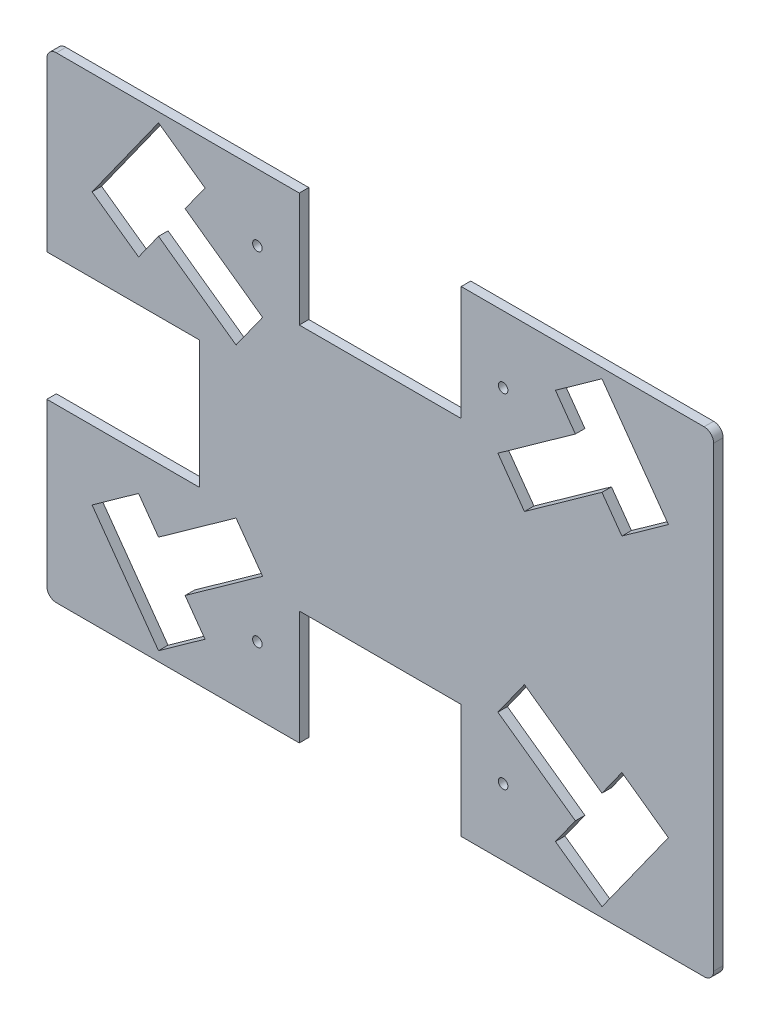
from build123d import *

# Parameters (mm, degrees)
ESQUISSE1_W              = 350
ESQUISSE1_H              = 250
BOSS_EXTRU_1_DEPTH       = 5
ENL_V_MAT_EXTRU_1_DEPTH  = 5
CONG_1_R                 = 5
ESQUISSE8_W              = 85
ESQUISSE8_H              = 60
ENL_V_MAT_EXTRU_12_DEPTH = 5
ESQUISSE9_R              = 2.5
ENL_V_MAT_EXTRU_14_DEPTH = 5
ESQUISSE10_W             = 80
ESQUISSE10_H             = 67
ENL_V_MAT_EXTRU_15_DEPTH = 10


with BuildPart() as part:
    # Esquisse1 → Boss.-Extru.1 (new body)
    with BuildSketch(Plane.XY):
        with Locations((0, 125)):
            Rectangle(ESQUISSE1_W, ESQUISSE1_H)
    extrude(amount=BOSS_EXTRU_1_DEPTH)

    # Esquisse2 → Enlèv. mat.-Extru.1 (cut)
    with BuildSketch(Plane.XY):
        Polygon((-61.749658188, 183.853742021), (-75.699374837, 164.324138712), (-116.386048398, 193.386048398), (-126.848335885, 178.738845916), (-151.260340021, 196.175991728), (-116.386048398, 245), (-91.974044262, 227.562854188), (-102.436331748, 212.915651707), align=None)
        Polygon((61.749658188, 183.853742021), (75.699374837, 164.324138712), (116.386048398, 193.386048398), (126.848335885, 178.738845916), (151.260340021, 196.175991728), (116.386048398, 245), (91.974044262, 227.562854188), (102.436331748, 212.915651707), align=None)
        Polygon((61.749658188, 66.146257979), (75.699374837, 85.675861288), (116.386048398, 56.613951602), (126.848335885, 71.261154084), (151.260340021, 53.824008272), (116.386048398, 5), (91.974044262, 22.437145812), (102.436331748, 37.084348293), align=None)
        Polygon((-61.749658188, 66.146257979), (-75.699374837, 85.675861288), (-116.386048398, 56.613951602), (-126.848335885, 71.261154084), (-151.260340021, 53.824008272), (-116.386048398, 5), (-91.974044262, 22.437145812), (-102.436331748, 37.084348293), align=None)
    extrude(amount=ENL_V_MAT_EXTRU_1_DEPTH, mode=Mode.SUBTRACT)

    # Congé1
    cong_1_edges = [part.edges().sort_by_distance(p)[0] for p in [
        (-175, 250, 2.5),
        (175, 250, 2.5),
        (175, 0, 2.5),
        (-175, 0, 2.5),
    ]]
    fillet(cong_1_edges, radius=CONG_1_R)

    # Esquisse8 → Enlèv. mat.-Extru.12 (cut)
    with BuildSketch(Plane.XY):
        with Locations((0, 220)):
            Rectangle(ESQUISSE8_W, ESQUISSE8_H)
        with Locations((0, 30)):
            Rectangle(ESQUISSE8_W, ESQUISSE8_H)
    extrude(amount=ENL_V_MAT_EXTRU_12_DEPTH, mode=Mode.SUBTRACT)

    # Esquisse9 → Enlèv. mat.-Extru.14 (cut)
    with BuildSketch(Plane.XY):
        with Locations((-64.5, 35)):
            Circle(ESQUISSE9_R)
        with Locations(Location((64.5, 35, 0), (0, 0, 180))):
            Circle(ESQUISSE9_R)
        with Locations((64.5, 215)):
            Circle(ESQUISSE9_R)
        with Locations(Location((-64.5, 215, 0), (0, 0, 180))):
            Circle(ESQUISSE9_R)
    extrude(amount=ENL_V_MAT_EXTRU_14_DEPTH, mode=Mode.SUBTRACT)

    # Esquisse10 → Enlèv. mat.-Extru.15 (cut)
    with BuildSketch(Plane.XY):
        with Locations((-135, 123.5)):
            Rectangle(ESQUISSE10_W, ESQUISSE10_H)
    extrude(amount=ENL_V_MAT_EXTRU_15_DEPTH, mode=Mode.SUBTRACT)


solid = part.part
